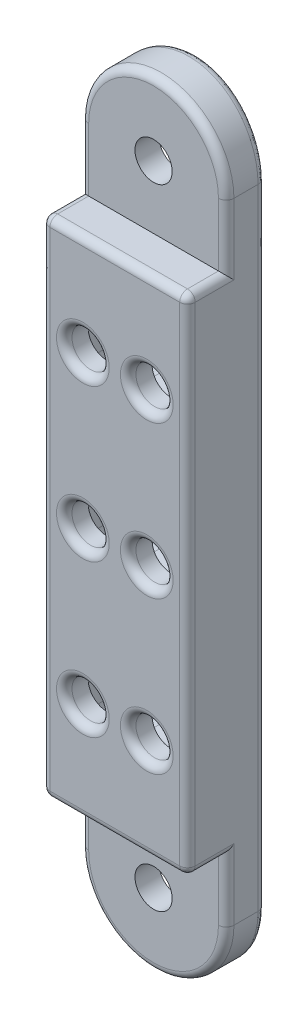
from build123d import *

# Parameters (mm, degrees)
MAIN_PROFILE_DEPTH                                  = 50.8
END_ROUNDS_DEPTH                                    = 25.4
SKETCH3_W                                           = 2.54
SKETCH3_H                                           = 4.7625
SKETCH3_H_2                                         = 4.1275
LOCATING_FLANGE_DEPTH                               = 53.111155755
BUTTON_POCKETS_DEPTH                                = 3.81
CBORE_FOR_2_BINDING_HEAD_MACHINE_SCREW1_D           = 2.4384
CBORE_FOR_2_BINDING_HEAD_MACHINE_SCREW1_CBORE_D     = 5.55752
CBORE_FOR_2_BINDING_HEAD_MACHINE_SCREW1_CBORE_DEPTH = 1.27
F_41_0_096_DIAMETER_HOLE1_D                         = 2.4384
FILLET1_R                                           = 0.508


with BuildPart() as part:
    # Sketch1 → Main profile (new body)
    with BuildSketch(Plane(origin=(0, 0, 0), x_dir=(1, 0, 0), z_dir=(0, 1, 0))):
        with BuildLine():
            Line((-4.191328185, 1.27), (5.333671815, 1.27))
            Line((5.333671815, 1.27), (5.333671815, 6.35))
            ThreePointArc((5.333671815, 6.35), (0.571171815, 6.648828143), (-4.191328185, 6.35))
            Line((-4.191328185, 6.35), (-4.191328185, 1.27))
        make_face()
    extrude(amount=MAIN_PROFILE_DEPTH)

    # Sketch2 → End rounds (cut)
    with BuildSketch(Plane.XY.offset(-1.27)):
        with BuildLine():
            Line((-4.191328185, 50.8), (-4.191328185, 46.0375))
            ThreePointArc((-4.191328185, 46.0375), (-2.796424231, 49.405096045), (0.571171815, 50.8))
            Line((0.571171815, 50.8), (-4.191328185, 50.8))
        make_face()
        with BuildLine():
            Line((5.333671815, 50.8), (0.571171815, 50.8))
            ThreePointArc((0.571171815, 50.8), (3.93876786, 49.405096045), (5.333671815, 46.0375))
            Line((5.333671815, 46.0375), (5.333671815, 50.8))
        make_face()
        with BuildLine():
            ThreePointArc((5.333671815, 4.7625), (3.938767861, 1.394903955), (0.571171817, 0))
            Line((0.571171817, 0), (5.333671815, 0))
            Line((5.333671815, 0), (5.333671815, 4.7625))
        make_face()
        with BuildLine():
            ThreePointArc((0.571171817, 0), (-2.79642423, 1.394903954), (-4.191328185, 4.7625))
            Line((-4.191328185, 4.7625), (-4.191328185, 0))
            Line((-4.191328185, 0), (0.571171817, 0))
        make_face()
    extrude(amount=-END_ROUNDS_DEPTH, mode=Mode.SUBTRACT)

    # Sketch3 → Locating Flange (cut, through all)
    with BuildSketch(Plane.ZY.offset(4.191328185)):
        with Locations((-2.54, 2.38125)):
            Rectangle(SKETCH3_W, SKETCH3_H)
        with Locations((-2.54, 6.82625)):
            Rectangle(SKETCH3_W, SKETCH3_H_2)
        with Locations((-2.54, 43.97375)):
            Rectangle(SKETCH3_W, SKETCH3_H_2)
        with Locations((-2.54, 48.41875)):
            Rectangle(SKETCH3_W, SKETCH3_H)
    extrude(amount=-LOCATING_FLANGE_DEPTH, mode=Mode.SUBTRACT)

    # Sketch4 → Button Pockets (cut)
    with BuildSketch(Plane(origin=(0, 0, -6.648828143), x_dir=(-1, 0, 0), z_dir=(0, 0, -1))):
        with BuildLine():
            Line((-2.349171815, 38.735), (1.206828185, 38.735))
            ThreePointArc((1.206828185, 38.735), (2.3293602, 38.270032015), (2.794328185, 37.1475))
            Line((2.794328185, 37.1475), (2.794328185, 33.5915))
            ThreePointArc((2.794328185, 33.5915), (2.3293602, 32.468967985), (1.206828185, 32.004))
            Line((1.206828185, 32.004), (-2.349171815, 32.004))
            ThreePointArc((-2.349171815, 32.004), (-3.47170383, 32.468967985), (-3.936671815, 33.5915))
            Line((-3.936671815, 33.5915), (-3.936671815, 37.1475))
            ThreePointArc((-3.936671815, 37.1475), (-3.47170383, 38.270032015), (-2.349171815, 38.735))
        make_face()
        with BuildLine():
            Line((-2.349171815, 28.7655), (1.206828185, 28.7655))
            ThreePointArc((1.206828185, 28.7655), (2.3293602, 28.300532015), (2.794328185, 27.178))
            Line((2.794328185, 27.178), (2.794328185, 23.622))
            ThreePointArc((2.794328185, 23.622), (2.3293602, 22.499467985), (1.206828185, 22.0345))
            Line((1.206828185, 22.0345), (-2.349171815, 22.0345))
            ThreePointArc((-2.349171815, 22.0345), (-3.47170383, 22.499467985), (-3.936671815, 23.622))
            Line((-3.936671815, 23.622), (-3.936671815, 27.178))
            ThreePointArc((-3.936671815, 27.178), (-3.47170383, 28.300532015), (-2.349171815, 28.7655))
        make_face()
        with BuildLine():
            Line((-2.349171815, 18.796), (1.206828185, 18.796))
            ThreePointArc((1.206828185, 18.796), (2.3293602, 18.331032015), (2.794328185, 17.2085))
            Line((2.794328185, 17.2085), (2.794328185, 13.6525))
            ThreePointArc((2.794328185, 13.6525), (2.3293602, 12.529967985), (1.206828185, 12.065))
            Line((1.206828185, 12.065), (-2.349171815, 12.065))
            ThreePointArc((-2.349171815, 12.065), (-3.47170383, 12.529967985), (-3.936671815, 13.6525))
            Line((-3.936671815, 13.6525), (-3.936671815, 17.2085))
            ThreePointArc((-3.936671815, 17.2085), (-3.47170383, 18.331032015), (-2.349171815, 18.796))
        make_face()
    extrude(amount=-BUTTON_POCKETS_DEPTH, mode=Mode.SUBTRACT)

    # CBORE for #2 Binding Head Machine Screw1 (through all)
    with Locations(Plane(origin=(0, 0, -6.648828143), x_dir=(-1, 0, 0), z_dir=(0, 0, -1))):
        with Locations((-0.571171815, 46.0375), (-0.571171815, 4.7625)):
            CounterBoreHole(CBORE_FOR_2_BINDING_HEAD_MACHINE_SCREW1_D / 2, CBORE_FOR_2_BINDING_HEAD_MACHINE_SCREW1_CBORE_D / 2, CBORE_FOR_2_BINDING_HEAD_MACHINE_SCREW1_CBORE_DEPTH)

    # #41 (0.096) Diameter Hole1 (through all)
    with Locations(Plane.XY.offset(-1.27)):
        with Locations((-1.524328185, 35.3695), (2.666671815, 35.3695), (2.666671815, 25.4), (-1.524328185, 25.4), (-1.524328185, 15.4305), (2.666671815, 15.4305)):
            Hole(F_41_0_096_DIAMETER_HOLE1_D / 2)

    # Fillet1
    fillet1_edges = [part.edges().sort_by_distance(p)[0] for p in [
        (5.333671815, 43.97375, -3.81),
        (5.333671815, 41.91, -2.54),
        (0.571171815, 41.91, -1.27),
        (-4.191328185, 43.97375, -3.81),
        (-4.191328185, 41.91, -2.54),
        (-4.191328185, 25.4, -6.35),
        (0.571171815, 50.8, -6.648828143),
        (3.349931815, 4.7625, -6.547360916),
        (3.349931815, 46.0375, -6.547360916),
        (3.885871815, 15.4305, -1.27),
        (-0.305128185, 15.4305, -1.27),
        (-0.305128185, 25.4, -1.27),
        (3.885871815, 25.4, -1.27),
        (0.571171817, 0, -6.648828143),
        (3.885871815, 35.3695, -1.27),
        (-0.305128185, 35.3695, -1.27),
        (5.333671815, 25.4, -6.35),
        (0.571171815, 50.8, -3.81),
        (0.571171815, 0, -3.81),
        (-4.191328185, 25.4, -1.27),
        (5.333671815, 25.4, -1.27),
        (0.571171815, 8.89, -1.27),
        (5.333671815, 6.82625, -3.81),
        (-4.191328185, 6.82625, -3.81),
        (-4.191328185, 8.89, -2.54),
        (5.333671815, 8.89, -2.54),
    ]]
    fillet(fillet1_edges, radius=FILLET1_R)


solid = part.part
